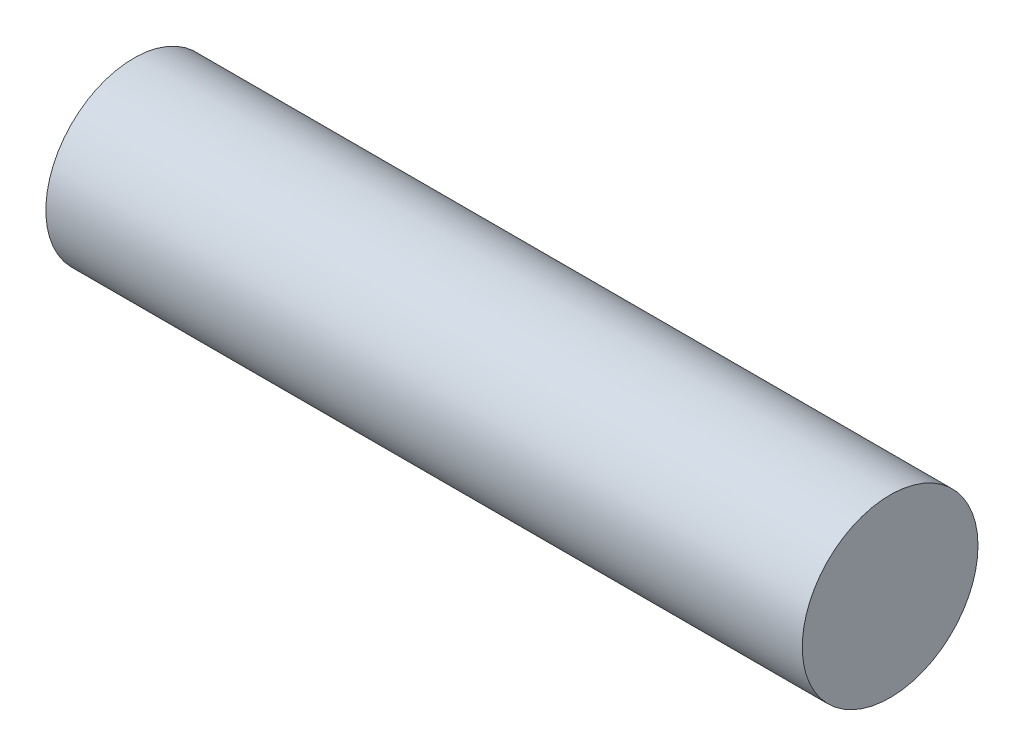
from build123d import *

# Parameters (mm, degrees)
SKETCH1_R           = 4.7625
BOSS_EXTRUDE1_DEPTH = 41


with BuildPart() as part:
    # Sketch1 → Boss-Extrude1 (new body)
    with BuildSketch(Plane(origin=(0, 0, 0), x_dir=(0, 0, -1), z_dir=(1, 0, 0))):
        Circle(SKETCH1_R)
    extrude(amount=BOSS_EXTRUDE1_DEPTH)


solid = part.part
